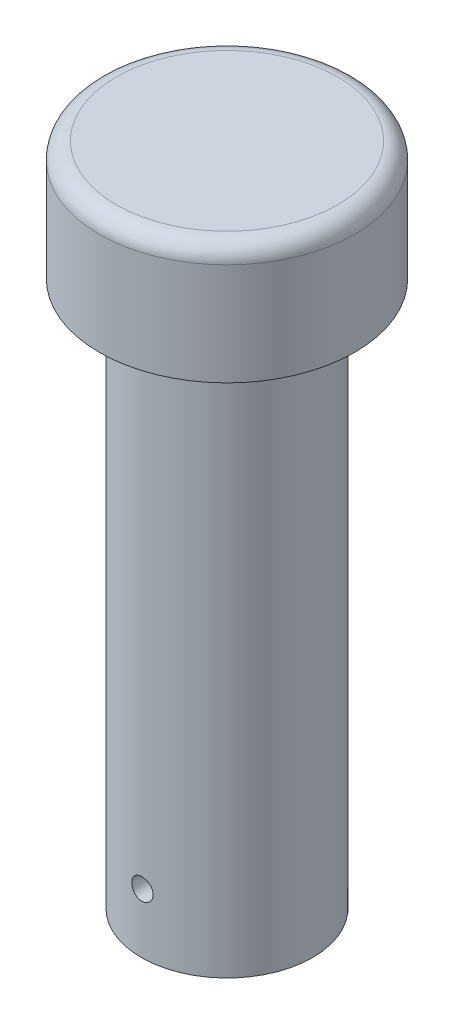
from build123d import *

# Parameters (mm, degrees)
SKETCH1_W               = 15
SKETCH1_H               = 4
FILLET3_R               = 2
CUT_EXTRUDE1_DEPTH      = 81.833161512
CUT_EXTRUDE1_DEPTH_BACK = 81.833161512
SKETCH2_R               = 1.25


with BuildPart() as part:
    # Sketch1 → Revolve2 (revolve)
    with BuildSketch(Plane.XY):
        with Locations((7.5, 76)):
            Rectangle(SKETCH1_W, SKETCH1_H)
        Polygon((0, 74), (0, 0), (10.049031003, 0), (10.049031003, 64), (15, 64), (15, 74), align=None)
    revolve(axis=Axis((0, 0, 0), (0, 1, 0)))

    # Fillet3
    fillet3_edges = [part.edges().sort_by_distance(p)[0] for p in [
        (-15, 78, 0),
    ]]
    fillet(fillet3_edges, radius=FILLET3_R)

    # Sketch2 → Cut-Extrude1 (cut, two sides: drawn at the far end of the back side and taken through both)
    with BuildSketch(Plane.XY.offset(-CUT_EXTRUDE1_DEPTH_BACK)):
        with Locations(Location((0.049031003, 7, 0), (0, 0, 180))):
            Circle(SKETCH2_R)
    extrude(amount=CUT_EXTRUDE1_DEPTH + CUT_EXTRUDE1_DEPTH_BACK, mode=Mode.SUBTRACT)


solid = part.part
